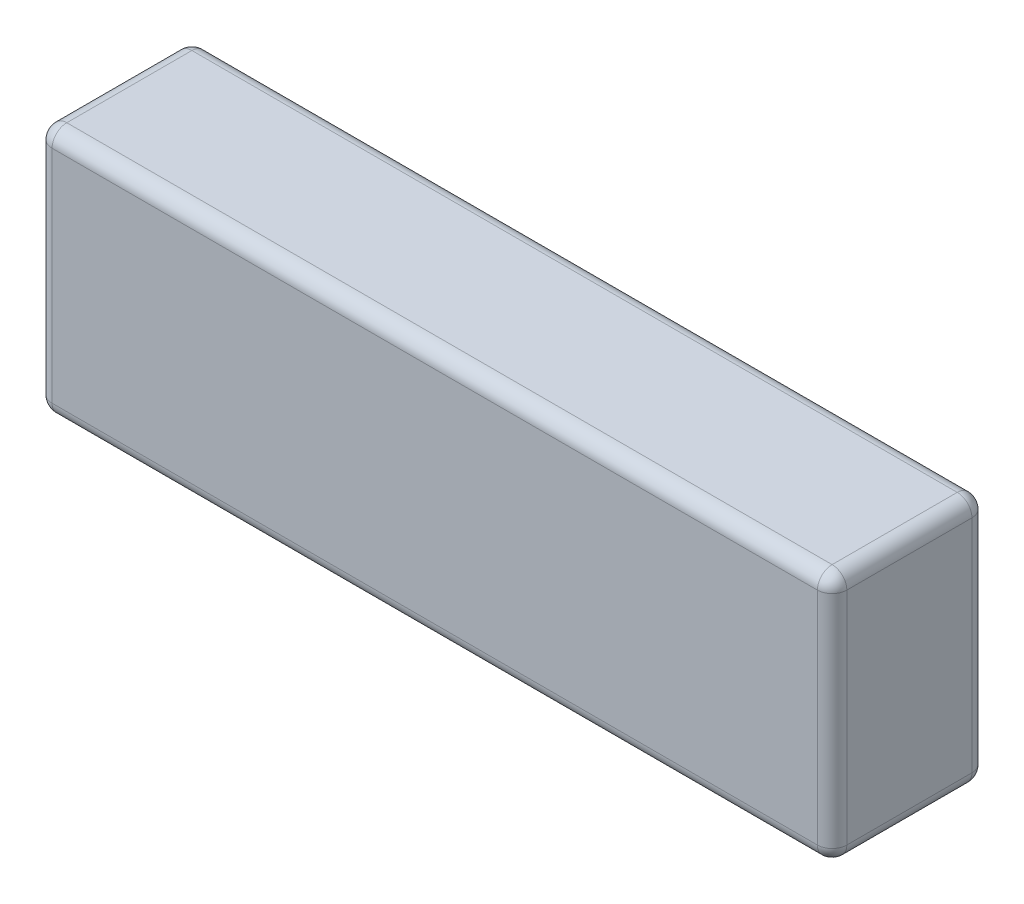
from build123d import *

# Parameters (mm, degrees)
SKETCH1_W           = 108
SKETCH1_H           = 34
BOSS_EXTRUDE1_DEPTH = 21
FILLET1_R           = 2


with BuildPart() as part:
    # Sketch1 → Boss-Extrude1 (new body)
    with BuildSketch(Plane.XY):
        Rectangle(SKETCH1_W, SKETCH1_H)
    extrude(amount=BOSS_EXTRUDE1_DEPTH)

    # Fillet1
    fillet1_edges = [part.edges().sort_by_distance(p)[0] for p in [
        (-54, 0, 21),
        (0, -17, 21),
        (54, 0, 21),
        (0, -17, 0),
        (-54, 0, 0),
        (0, 17, 0),
        (54, 0, 0),
        (54, -17, 10.5),
        (-54, -17, 10.5),
        (-54, 17, 10.5),
        (54, 17, 10.5),
        (0, 17, 21),
    ]]
    fillet(fillet1_edges, radius=FILLET1_R)


solid = part.part
